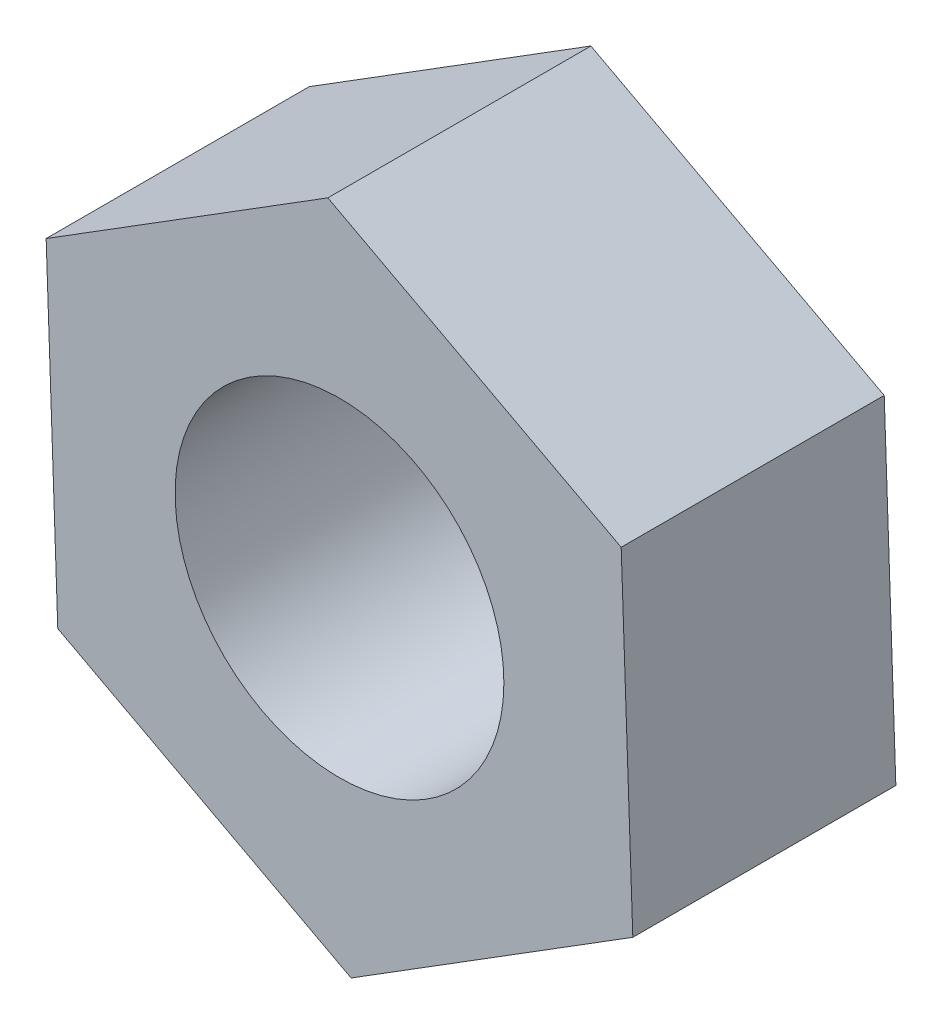
from build123d import *

# Parameters (mm, degrees)
SKETCH_1_R      = 2
EXTRUDE_1_DEPTH = 3.2


with BuildPart() as part:
    # ｽｹｯﾁ1 → ﾎﾞｽ - 押し出し1 (new body)
    with BuildSketch(Plane.XY):
        Polygon((3.427136505, 2.141977756), (-0.141438899, 4.038976154), (-3.568575404, 1.896998398), (-3.427136505, -2.141977756), (0.141438899, -4.038976154), (3.568575404, -1.896998398), align=None)
        Circle(SKETCH_1_R, mode=Mode.SUBTRACT)
    extrude(amount=EXTRUDE_1_DEPTH)


solid = part.part
